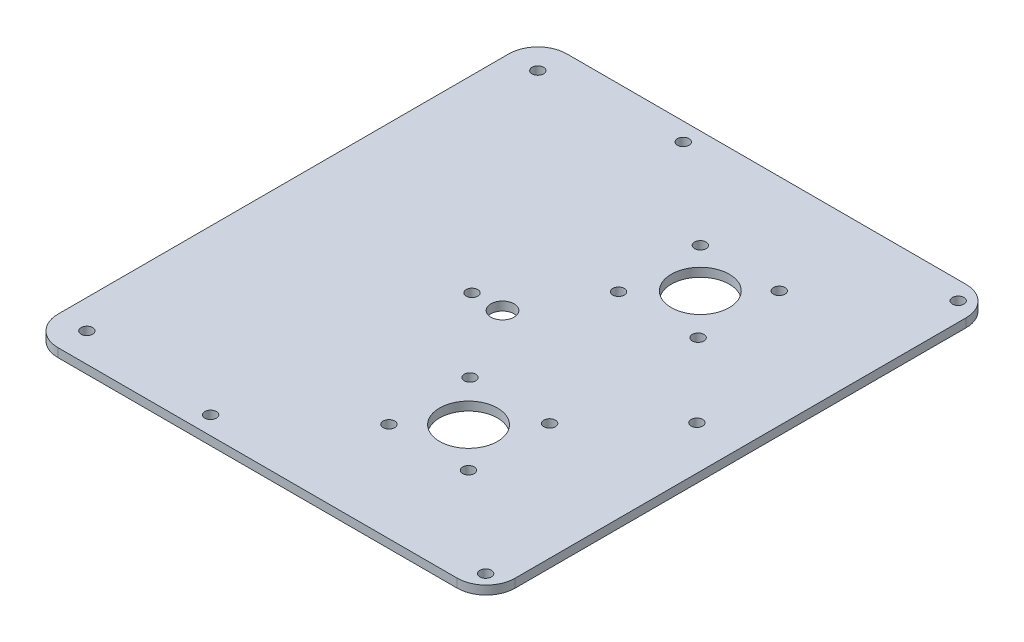
from build123d import *

# Parameters (mm, degrees)
SKETCH_1_R      = 2
SKETCH_1_R_2    = 10
SKETCH_1_R_3    = 4
EXTRUDE_1_DEPTH = 3


with BuildPart() as part:
    # 草图1 → 凸台-拉伸1 (new body)
    with BuildSketch(Plane(origin=(0, 0, 0), x_dir=(1, 0, 0), z_dir=(0, 1, 0))):
        with BuildLine():
            Line((-78.915, 77.83), (-78.915, -77.83))
            ThreePointArc((-78.915, -77.83), (-75.986067812, -84.901067812), (-68.915, -87.83))
            Line((-68.915, -87.83), (68.915, -87.83))
            ThreePointArc((68.915, -87.83), (75.986067812, -84.901067812), (78.915, -77.83))
            Line((78.915, -77.83), (78.915, 77.83))
            ThreePointArc((78.915, 77.83), (75.986067812, 84.901067812), (68.915, 87.83))
            Line((68.915, 87.83), (-68.915, 87.83))
            ThreePointArc((-68.915, 87.83), (-75.986067812, 84.901067812), (-78.915, 77.83))
        make_face()
        with Locations(Location((72.465, 81.57, 0), (0, 0, 270))):
            Circle(SKETCH_1_R, mode=Mode.SUBTRACT)
        with Locations(Location((72.465, -81.57, 0), (0, 0, 90))):
            Circle(SKETCH_1_R, mode=Mode.SUBTRACT)
        with Locations(Location((-22.465, -81.57, 0), (0, 0, 270))):
            Circle(SKETCH_1_R, mode=Mode.SUBTRACT)
        with Locations(Location((-22.465, 81.57, 0), (0, 0, 90))):
            Circle(SKETCH_1_R, mode=Mode.SUBTRACT)
        with Locations(Location((-68.915, 77.83, 0), (0, 0, 270))):
            Circle(SKETCH_1_R, mode=Mode.SUBTRACT)
        with Locations(Location((-68.915, -77.83, 0), (0, 0, 90))):
            Circle(SKETCH_1_R, mode=Mode.SUBTRACT)
        with Locations(Location((25, 40, 0), (0, 0, 270))):
            Circle(SKETCH_1_R_2, mode=Mode.SUBTRACT)
        with Locations(Location((38.610158608, 53.633692132, 0), (0, 0, 90))):
            Circle(SKETCH_1_R, mode=Mode.SUBTRACT)
        with Locations(Location((38.610158608, 25.633692132, 0), (0, 0, 270))):
            Circle(SKETCH_1_R, mode=Mode.SUBTRACT)
        with Locations(Location((11.144228788, 25.633692132, 0), (0, 0, 90))):
            Circle(SKETCH_1_R, mode=Mode.SUBTRACT)
        with Locations(Location((25, -40, 0), (0, 0, 90))):
            Circle(SKETCH_1_R_2, mode=Mode.SUBTRACT)
        with Locations(Location((11.144228788, -25.633692132, 0), (0, 0, 270))):
            Circle(SKETCH_1_R, mode=Mode.SUBTRACT)
        with Locations(Location((38.610158608, -25.633692132, 0), (0, 0, 90))):
            Circle(SKETCH_1_R, mode=Mode.SUBTRACT)
        with Locations(Location((38.610158608, -53.633692132, 0), (0, 0, 270))):
            Circle(SKETCH_1_R, mode=Mode.SUBTRACT)
        with Locations(Location((11.144228788, -53.633692132, 0), (0, 0, 90))):
            Circle(SKETCH_1_R, mode=Mode.SUBTRACT)
        with Locations(Location((11.389841392, 53.633692132, 0), (0, 0, 270))):
            Circle(SKETCH_1_R, mode=Mode.SUBTRACT)
        with Locations(Location((63.82629955, 0, 0), (0, 0, 270))):
            Circle(SKETCH_1_R, mode=Mode.SUBTRACT)
        with Locations(Location((-13.82629955, 0, 0), (0, 0, 90))):
            Circle(SKETCH_1_R, mode=Mode.SUBTRACT)
        with Locations(Location((-3.290231438, 0, 0), (0, 0, 270))):
            Circle(SKETCH_1_R_3, mode=Mode.SUBTRACT)
    extrude(amount=EXTRUDE_1_DEPTH)


solid = part.part
